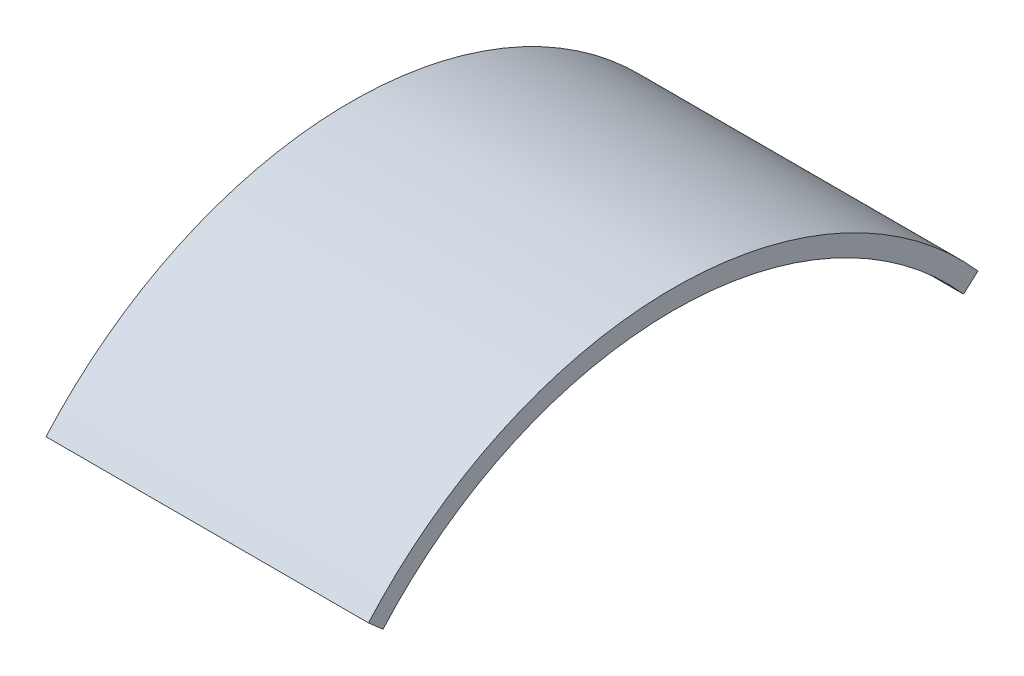
from build123d import *

# Parameters (mm, degrees)
BOSS_EXTRUDE1_DEPTH = 50


with BuildPart() as part:
    # Sketch1 → Boss-Extrude1 (new body)
    with BuildSketch(Plane(origin=(0, 0, 0), x_dir=(0, 0, -1), z_dir=(1, 0, 0))):
        with BuildLine():
            Line((-45, 39.686269666), (-47.25, 41.670583149))
            ThreePointArc((-47.25, 41.670583149), (0, 63), (47.25, 41.670583149))
            Line((47.25, 41.670583149), (45, 39.686269666))
            ThreePointArc((45, 39.686269666), (0, 60), (-45, 39.686269666))
        make_face()
    extrude(amount=BOSS_EXTRUDE1_DEPTH)


solid = part.part
